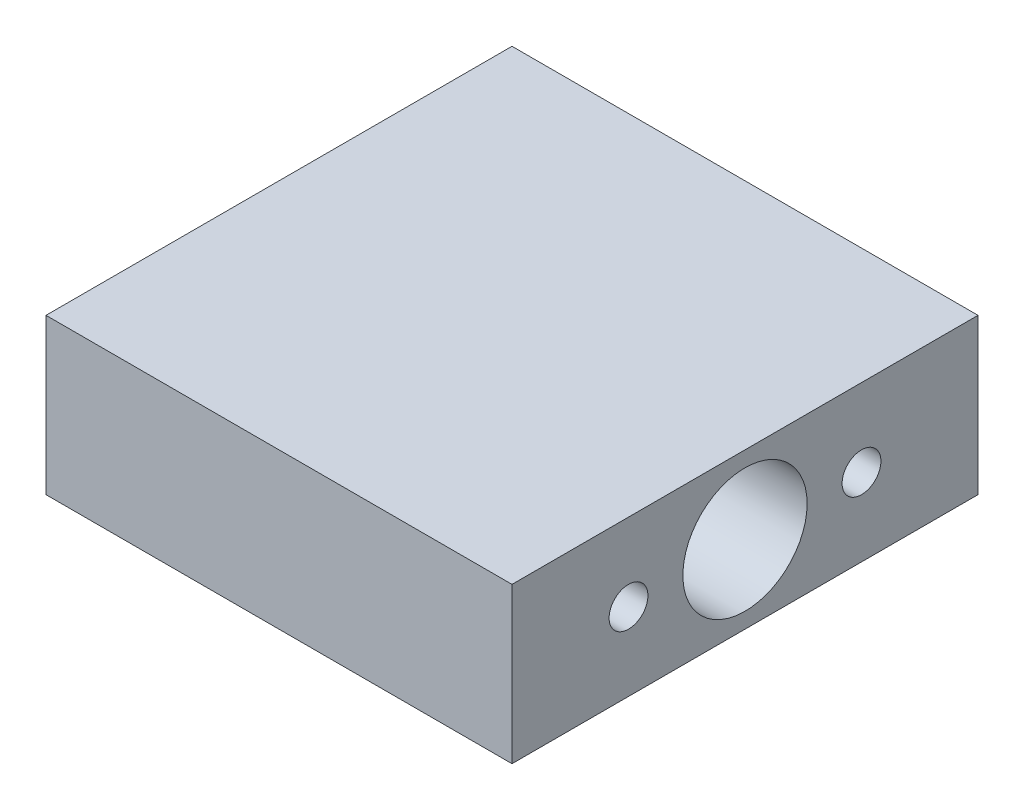
from build123d import *

# Parameters (mm, degrees)
SKETCH1_W           = 38.1
SKETCH1_H           = 12.7
BOSS_EXTRUDE1_DEPTH = 38.1
SKETCH2_R           = 5.08
SKETCH2_R_2         = 1.5875
CUT_EXTRUDE1_DEPTH  = 56.358016583


with BuildPart() as part:
    # Sketch1 → Boss-Extrude1 (new body)
    with BuildSketch(Plane(origin=(0, 0, 0), x_dir=(0, 0, -1), z_dir=(1, 0, 0))):
        with Locations((19.05, 6.35)):
            Rectangle(SKETCH1_W, SKETCH1_H)
    extrude(amount=BOSS_EXTRUDE1_DEPTH)

    # Sketch2 → Cut-Extrude1 (cut, through all)
    with BuildSketch(Plane(origin=(38.1, 0, 0), x_dir=(0, 0, -1), z_dir=(1, 0, 0))):
        with Locations((19.05, 6.35)):
            Circle(SKETCH2_R)
        with Locations((9.525, 6.35)):
            Circle(SKETCH2_R_2)
        with Locations((28.575, 6.35)):
            Circle(SKETCH2_R_2)
    extrude(amount=-CUT_EXTRUDE1_DEPTH, mode=Mode.SUBTRACT)


solid = part.part
